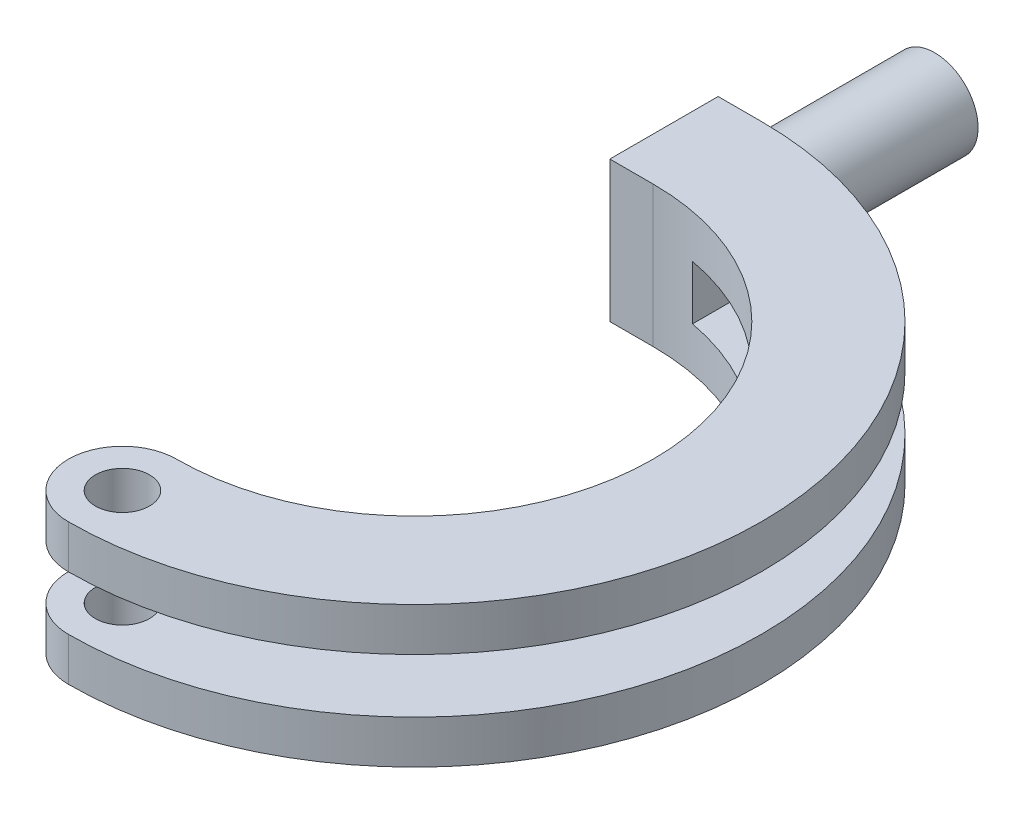
from build123d import *

# Parameters (mm, degrees)
SKETCH1_R           = 1.25
BOSS_EXTRUDE1_DEPTH = 2
LPATTERN1_COUNT     = 2
LPATTERN1_PITCH     = 4.5
BOSS_EXTRUDE2_DEPTH = 2.5
SKETCH4_R           = 2
BOSS_EXTRUDE3_DEPTH = 8


with BuildPart() as part:
    # Sketch1 → Boss-Extrude1 (new body)
    with BuildSketch(Plane(origin=(0, 0, 0), x_dir=(1, 0, 0), z_dir=(0, 1, 0))):
        with BuildLine():
            Line((0, 11), (-2, 11))
            Line((-2, 11), (-2, 16))
            Line((-2, 16), (0, 16))
            ThreePointArc((0, 16), (16, 0), (0, -16))
            ThreePointArc((0, -16), (-2.5, -13.5), (0, -11))
            ThreePointArc((0, -11), (11, 0), (0, 11))
        make_face()
        with Locations(Location((0, -13.5, 0), (0, 0, 270))):
            Circle(SKETCH1_R, mode=Mode.SUBTRACT)
    extrude(amount=BOSS_EXTRUDE1_DEPTH)


with BuildPart() as lpattern1_1:
    # LPattern1: pattern copy
    add(part.part.moved(Location(Vector(0, 1, 0) * (1 * LPATTERN1_PITCH))))


with BuildPart() as part_1:
    add(part.part)

    add(lpattern1_1.part)  # Boss-Extrude2 merges LPattern1_1
    # Sketch3 → Boss-Extrude2 (add)
    with BuildSketch(Plane(origin=(0, 2, 0), x_dir=(1, 0, 0), z_dir=(0, 1, 0))):
        with BuildLine():
            Line((-2, 16), (-2, 11))
            Line((-2, 11), (0, 11))
            ThreePointArc((0, 11), (1.004193186, 10.954067557), (2, 10.816653826))
            Line((2, 10.816653826), (2, 15.874507866))
            ThreePointArc((2, 15.874507866), (1.001966601, 15.968596148), (0, 16))
            Line((0, 16), (-2, 16))
        make_face()
    extrude(amount=BOSS_EXTRUDE2_DEPTH)

    # Sketch4 → Boss-Extrude3 (add)
    with BuildSketch(Plane(origin=(0, 0, -16), x_dir=(-1, 0, 0), z_dir=(0, 0, -1))):
        with Locations((0, 3.25)):
            Circle(SKETCH4_R)
    extrude(amount=BOSS_EXTRUDE3_DEPTH)


solid = part_1.part
